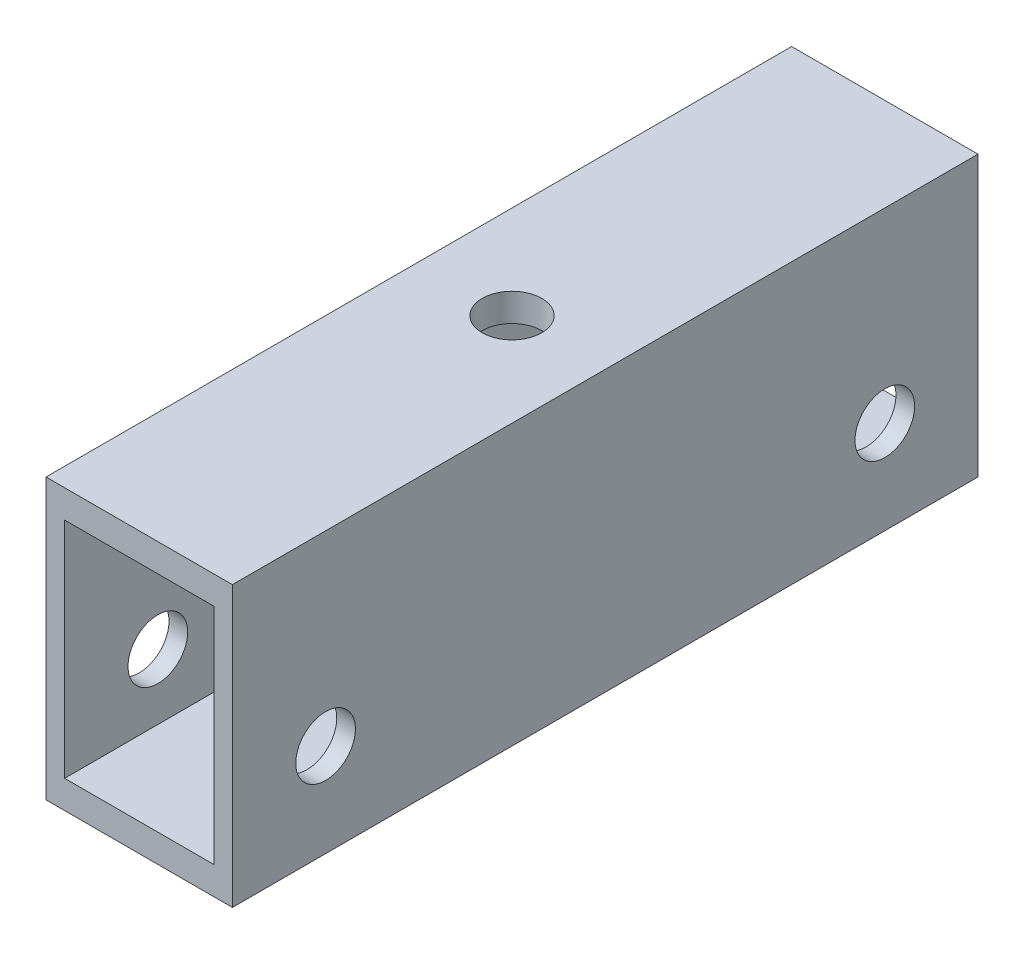
from build123d import *

# Parameters (mm, degrees)
SKETCH_1_W          = 10
SKETCH_1_H          = 15
SKETCH_1_W_2        = 8
SKETCH_1_H_2        = 12
EXTRUDE_1_DEPTH     = 40
SKETCH_2_R          = 1.6
CUT_EXTRUDE_1_DEPTH = 44.011626335
SKETCH_3_R          = 1.6
CUT_EXTRUDE_2_DEPTH = 42.907636536


with BuildPart() as part:
    # ｽｹｯﾁ1 → ﾎﾞｽ - 押し出し1 (new body)
    with BuildSketch(Plane.XY):
        Rectangle(SKETCH_1_W, SKETCH_1_H)
        Rectangle(SKETCH_1_W_2, SKETCH_1_H_2, mode=Mode.SUBTRACT)
    extrude(amount=EXTRUDE_1_DEPTH)

    # ｽｹｯﾁ2 → ｶｯﾄ - 押し出し1 (cut, through all)
    with BuildSketch(Plane(origin=(0, 7.5, 0), x_dir=(1, 0, 0), z_dir=(0, 1, 0))):
        with Locations(Location((0, -20, 0), (0, 0, 270))):
            Circle(SKETCH_2_R)
    extrude(amount=-CUT_EXTRUDE_1_DEPTH, mode=Mode.SUBTRACT)

    # ｽｹｯﾁ3 → ｶｯﾄ - 押し出し2 (cut, through all)
    with BuildSketch(Plane(origin=(5, 0, 0), x_dir=(0, 0, -1), z_dir=(1, 0, 0))):
        with Locations(Location((-35, -2.5, 0), (0, 0, 90))):
            Circle(SKETCH_3_R)
        with Locations(Location((-5, -2.5, 0), (0, 0, 90))):
            Circle(SKETCH_3_R)
    extrude(amount=-CUT_EXTRUDE_2_DEPTH, mode=Mode.SUBTRACT)


solid = part.part
